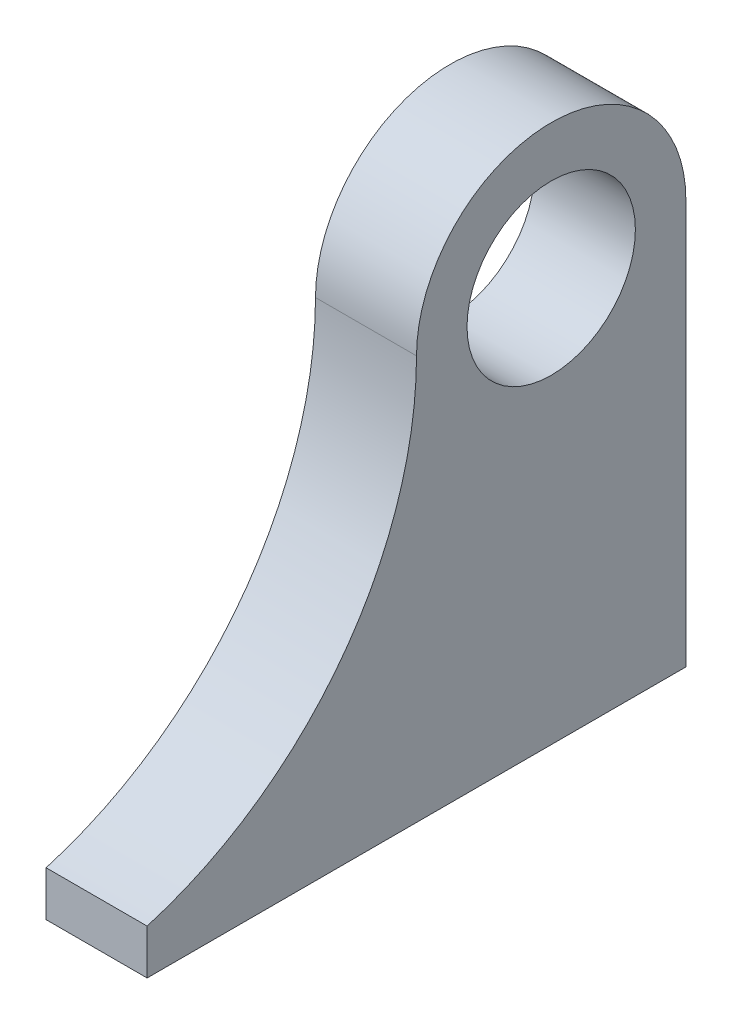
from build123d import *

# Parameters (mm, degrees)
CROQUIS1_W              = 4.7625
CROQUIS1_H              = 42.333333333
SALIENTE_EXTRUIR1_DEPTH = 25.4
CROQUIS2_R              = 3.96875
CORTAR_EXTRUIR1_DEPTH   = 25.4


with BuildPart() as part:
    # Croquis1 → Saliente-Extruir1 (new body)
    with BuildSketch(Plane(origin=(0, 0, 0), x_dir=(1, 0, 0), z_dir=(0, 1, 0))):
        with Locations((604.572916667, 432.985333334)):
            Rectangle(CROQUIS1_W, CROQUIS1_H)
    extrude(amount=SALIENTE_EXTRUIR1_DEPTH)

    # Croquis2 → Cortar-Extruir1 (cut)
    with BuildSketch(Plane(origin=(606.954166667, 0, 0), x_dir=(0, 0, -1), z_dir=(1, 0, 0))):
        with BuildLine():
            ThreePointArc((426.635333333, 19.05), (428.495205273, 23.540128061), (432.985333333, 25.4))
            Line((432.985333333, 25.4), (411.818666667, 25.4))
            Line((411.818666667, 25.4), (411.818666667, 0))
            Line((411.818666667, 0), (413.935333333, 0))
            Line((413.935333333, 0), (413.935333333, 2.12))
            ThreePointArc((413.935333333, 2.12), (423.10744442, 8.467999953), (426.635333333, 19.05))
        make_face()
        with BuildLine():
            ThreePointArc((432.985333333, 25.4), (437.475461394, 23.540128061), (439.335333333, 19.05))
            Line((439.335333333, 19.05), (439.335333333, 0))
            Line((439.335333333, 0), (454.152, 0))
            Line((454.152, 0), (454.152, 25.4))
            Line((454.152, 25.4), (432.985333333, 25.4))
        make_face()
        with Locations((432.985333333, 19.05)):
            Circle(CROQUIS2_R)
    extrude(amount=-CORTAR_EXTRUIR1_DEPTH, mode=Mode.SUBTRACT)


solid = part.part
